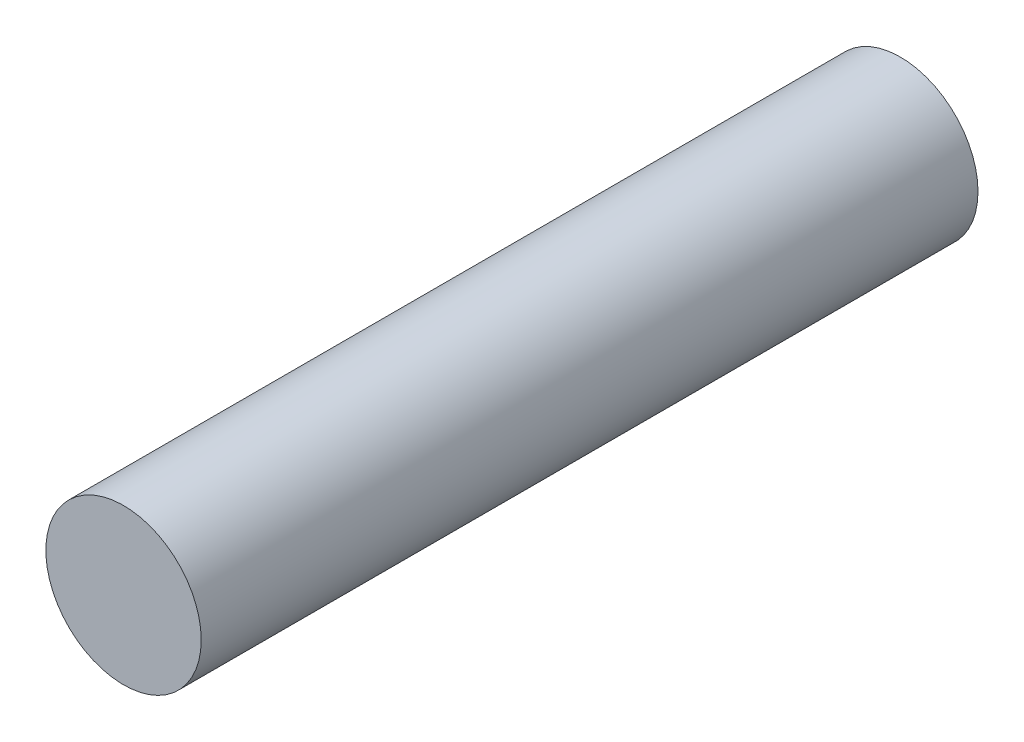
from build123d import *

# Parameters (mm, degrees)
SKETCH_1_R      = 1
EXTRUDE_2_DEPTH = 10


with BuildPart() as part:
    # 草图1 → 凸台-拉伸2 (new body)
    with BuildSketch(Plane.XY):
        Circle(SKETCH_1_R)
    extrude(amount=EXTRUDE_2_DEPTH)


solid = part.part
